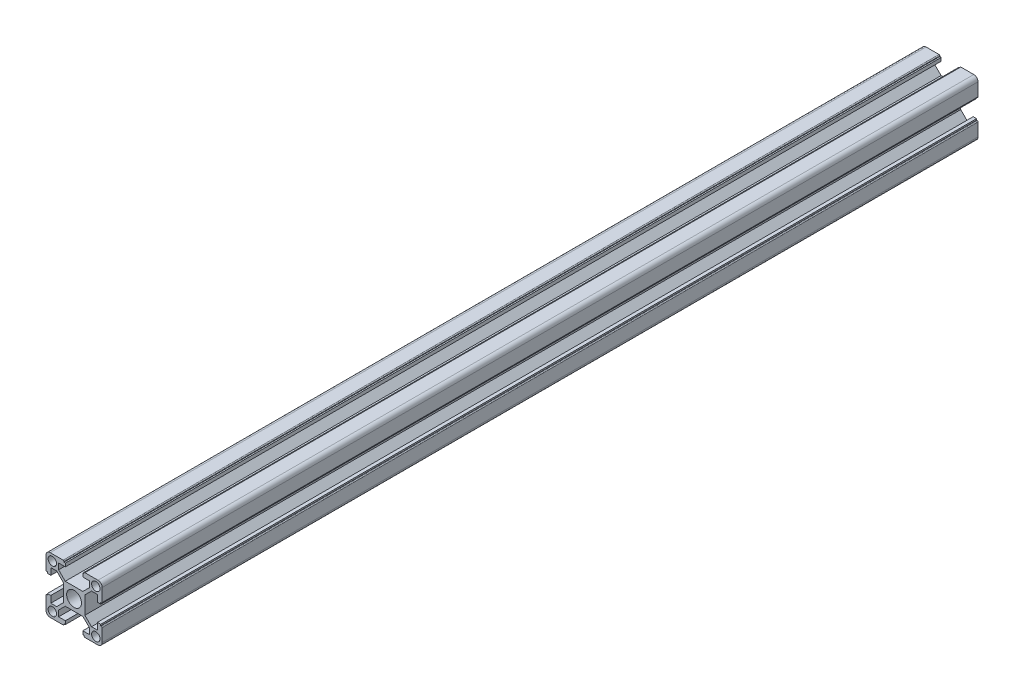
from build123d import *

# Parameters (mm, degrees)
SKETCH_1_R      = 2.65
SKETCH_1_R_2    = 1.5
EXTRUDE_1_DEPTH = 156


with BuildPart() as part:
    # 草图1 → 凸台-拉伸1 (new, symmetric)
    with BuildSketch(Plane.XY):
        with BuildLine():
            Line((3.142893219, 3.85), (-3.142893219, 3.85))
            Line((-3.142893219, 3.85), (-5.5, 6.207106781))
            Line((-5.5, 6.207106781), (-5.5, 8.3))
            Line((-5.5, 8.3), (-3.1, 8.3))
            Line((-3.1, 8.3), (-3.1, 9.5))
            Line((-3.1, 9.5), (-3.6, 9.5))
            Line((-3.6, 9.5), (-3.6, 9.7))
            ThreePointArc((-3.6, 9.7), (-3.687867966, 9.912132034), (-3.9, 10))
            Line((-3.9, 10), (-8.5, 10))
            ThreePointArc((-8.5, 10), (-9.560660172, 9.560660172), (-10, 8.5))
            Line((-10, 8.5), (-10, 3.9))
            ThreePointArc((-10, 3.9), (-9.912132034, 3.687867966), (-9.7, 3.6))
            Line((-9.7, 3.6), (-9.5, 3.6))
            Line((-9.5, 3.6), (-9.5, 3.1))
            Line((-9.5, 3.1), (-8.3, 3.1))
            Line((-8.3, 3.1), (-8.3, 5.5))
            Line((-8.3, 5.5), (-6.207106781, 5.5))
            Line((-6.207106781, 5.5), (-3.85, 3.142893219))
            Line((-3.85, 3.142893219), (-3.85, -3.142893219))
            Line((-3.85, -3.142893219), (-6.207106781, -5.5))
            Line((-6.207106781, -5.5), (-8.3, -5.5))
            Line((-8.3, -5.5), (-8.3, -3.1))
            Line((-8.3, -3.1), (-9.5, -3.1))
            Line((-9.5, -3.1), (-9.5, -3.6))
            Line((-9.5, -3.6), (-9.7, -3.6))
            ThreePointArc((-9.7, -3.6), (-9.912132034, -3.687867966), (-10, -3.9))
            Line((-10, -3.9), (-10, -8.5))
            ThreePointArc((-10, -8.5), (-9.560660172, -9.560660172), (-8.5, -10))
            Line((-8.5, -10), (-3.9, -10))
            ThreePointArc((-3.9, -10), (-3.687867966, -9.912132034), (-3.6, -9.7))
            Line((-3.6, -9.7), (-3.6, -9.5))
            Line((-3.6, -9.5), (-3.1, -9.5))
            Line((-3.1, -9.5), (-3.1, -8.3))
            Line((-3.1, -8.3), (-5.5, -8.3))
            Line((-5.5, -8.3), (-5.5, -6.207106781))
            Line((-5.5, -6.207106781), (-3.142893219, -3.85))
            Line((-3.142893219, -3.85), (3.142893219, -3.85))
            Line((3.142893219, -3.85), (5.5, -6.207106781))
            Line((5.5, -6.207106781), (5.5, -8.3))
            Line((5.5, -8.3), (3.1, -8.3))
            Line((3.1, -8.3), (3.1, -9.5))
            Line((3.1, -9.5), (3.6, -9.5))
            Line((3.6, -9.5), (3.6, -9.7))
            ThreePointArc((3.6, -9.7), (3.687867966, -9.912132034), (3.9, -10))
            Line((3.9, -10), (8.5, -10))
            ThreePointArc((8.5, -10), (9.560660172, -9.560660172), (10, -8.5))
            Line((10, -8.5), (10, -3.9))
            ThreePointArc((10, -3.9), (9.912132034, -3.687867966), (9.7, -3.6))
            Line((9.7, -3.6), (9.5, -3.6))
            Line((9.5, -3.6), (9.5, -3.1))
            Line((9.5, -3.1), (8.3, -3.1))
            Line((8.3, -3.1), (8.3, -5.5))
            Line((8.3, -5.5), (6.207106781, -5.5))
            Line((6.207106781, -5.5), (3.85, -3.142893219))
            Line((3.85, -3.142893219), (3.85, 3.142893219))
            Line((3.85, 3.142893219), (6.207106781, 5.5))
            Line((6.207106781, 5.5), (8.3, 5.5))
            Line((8.3, 5.5), (8.3, 3.1))
            Line((8.3, 3.1), (9.5, 3.1))
            Line((9.5, 3.1), (9.5, 3.6))
            Line((9.5, 3.6), (9.7, 3.6))
            ThreePointArc((9.7, 3.6), (9.912132034, 3.687867966), (10, 3.9))
            Line((10, 3.9), (10, 8.5))
            ThreePointArc((10, 8.5), (9.560660172, 9.560660172), (8.5, 10))
            Line((8.5, 10), (3.9, 10))
            ThreePointArc((3.9, 10), (3.687867966, 9.912132034), (3.6, 9.7))
            Line((3.6, 9.7), (3.6, 9.5))
            Line((3.6, 9.5), (3.1, 9.5))
            Line((3.1, 9.5), (3.1, 8.3))
            Line((3.1, 8.3), (5.5, 8.3))
            Line((5.5, 8.3), (5.5, 6.207106781))
            Line((5.5, 6.207106781), (3.142893219, 3.85))
        make_face()
        Circle(SKETCH_1_R, mode=Mode.SUBTRACT)
        with Locations((-7.75, 7.75)):
            Circle(SKETCH_1_R_2, mode=Mode.SUBTRACT)
        with Locations((7.75, 7.75)):
            Circle(SKETCH_1_R_2, mode=Mode.SUBTRACT)
        with Locations((7.75, -7.75)):
            Circle(SKETCH_1_R_2, mode=Mode.SUBTRACT)
        with Locations((-7.75, -7.75)):
            Circle(SKETCH_1_R_2, mode=Mode.SUBTRACT)
    extrude(amount=EXTRUDE_1_DEPTH, both=True)


solid = part.part
